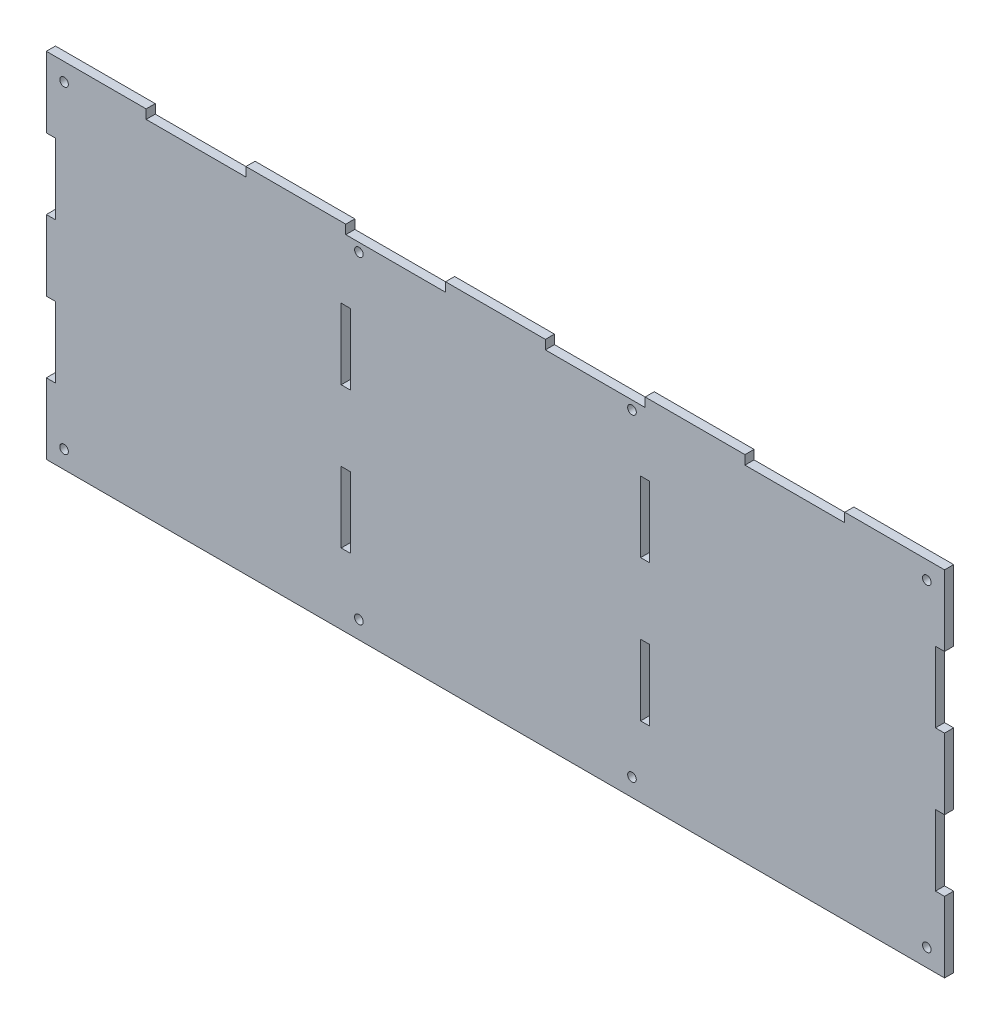
from build123d import *

# Parameters (mm, degrees)
SKETCH1_R           = 1.5
SKETCH1_W           = 3.175
SKETCH1_H           = 24.635
BOSS_EXTRUDE1_DEPTH = 3.175


with BuildPart() as part:
    # Sketch1 → Boss-Extrude1 (new body)
    with BuildSketch(Plane.XY):
        Polygon((0, 0), (313, 0), (313, 24.635), (309.825, 24.635), (309.825, 49.27), (313, 49.27), (313, 73.905), (309.825, 73.905), (309.825, 98.54), (313, 98.54), (313, 123.175), (278.222222222, 123.175), (278.222222222, 120), (243.444444444, 120), (243.444444444, 123.175), (208.666666667, 123.175), (208.666666667, 120), (173.888888889, 120), (173.888888889, 123.175), (139.111111111, 123.175), (139.111111111, 120), (104.333333333, 120), (104.333333333, 123.175), (69.555555556, 123.175), (69.555555556, 120), (34.777777778, 120), (34.777777778, 123.175), (0, 123.175), (0, 98.54), (3.175, 98.54), (3.175, 73.905), (0, 73.905), (0, 49.27), (3.175, 49.27), (3.175, 24.635), (0, 24.635), align=None)
        with Locations((6.175, 117)):
            Circle(SKETCH1_R, mode=Mode.SUBTRACT)
        with Locations((108.920833333, 117)):
            Circle(SKETCH1_R, mode=Mode.SUBTRACT)
        with Locations(Location((108.920833333, 6.175, 0), (0, 0, 180))):
            Circle(SKETCH1_R, mode=Mode.SUBTRACT)
        with Locations(Location((6.175, 6.175, 0), (0, 0, 180))):
            Circle(SKETCH1_R, mode=Mode.SUBTRACT)
        with Locations((306.825, 6.175)):
            Circle(SKETCH1_R, mode=Mode.SUBTRACT)
        with Locations((204.079166667, 6.175)):
            Circle(SKETCH1_R, mode=Mode.SUBTRACT)
        with Locations(Location((204.079166667, 117, 0), (0, 0, 180))):
            Circle(SKETCH1_R, mode=Mode.SUBTRACT)
        with Locations(Location((306.825, 117, 0), (0, 0, 180))):
            Circle(SKETCH1_R, mode=Mode.SUBTRACT)
        with Locations((104.333333333, 86.2225)):
            Rectangle(SKETCH1_W, SKETCH1_H, mode=Mode.SUBTRACT)
        with Locations((104.333333333, 36.9525)):
            Rectangle(SKETCH1_W, SKETCH1_H, mode=Mode.SUBTRACT)
        with Locations((208.666666667, 86.2225)):
            Rectangle(SKETCH1_W, SKETCH1_H, mode=Mode.SUBTRACT)
        with Locations((208.666666667, 36.9525)):
            Rectangle(SKETCH1_W, SKETCH1_H, mode=Mode.SUBTRACT)
    extrude(amount=BOSS_EXTRUDE1_DEPTH)


solid = part.part
